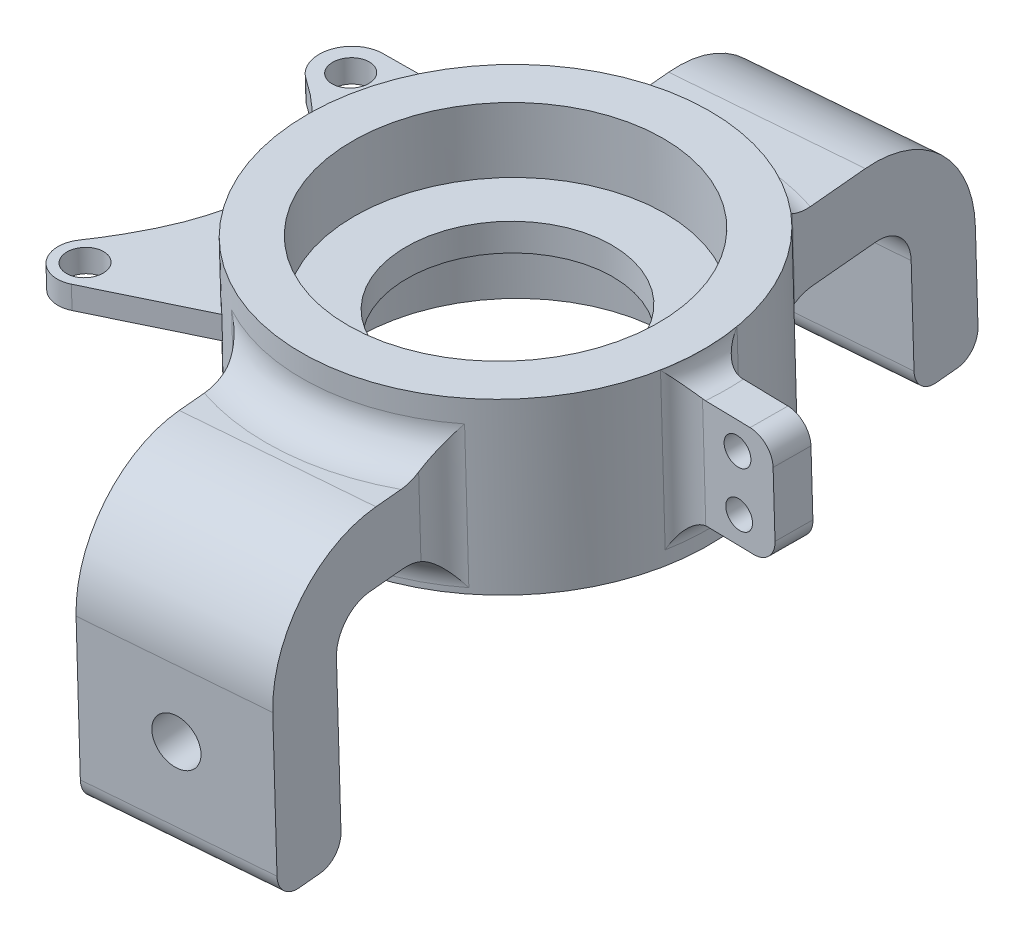
from build123d import *

# Parameters (mm, degrees)
BOSS_EXTRUDE1_DEPTH      = 20
BOSS_EXTRUDE1_DEPTH_BACK = 20
FILLET1_R                = 25
FILLET2_R                = 8
FILLET3_R                = 5
SKETCH2_R                = 5
CUT_EXTRUDE1_DEPTH       = 20
SKETCH5_R                = 5
CUT_EXTRUDE2_DEPTH       = 20
SKETCH6_R                = 44
CUT_EXTRUDE3_DEPTH       = 29.228201781
SKETCH7_R                = 44
SKETCH7_R_2              = 34
BOSS_EXTRUDE2_DEPTH      = 45.1
FILLET4_R                = 8
BOSS_EXTRUDE5_DEPTH      = 12
BOSS_EXTRUDE5_DEPTH_BACK = 12
FILLET9_R                = 5
SKETCH14_R               = 3
CUT_EXTRUDE6_DEPTH       = 8
FILLET10_R               = 5
SKETCH15_R               = 4
BOSS_EXTRUDE6_DEPTH      = 5
SKETCH17_R               = 34
SKETCH17_R_2             = 22.5
BOSS_EXTRUDE7_DEPTH      = 6
BOSS_EXTRUDE8_DEPTH      = 5
SKETCH7_3_R              = 44
SKETCH7_3_R_2            = 34
CUT_EXTRUDE7_DEPTH       = 5
SKETCH25_R               = 10.081703308
SKETCH25_R_2             = 0.081703308
SKETCH25_R_3             = 54
SKETCH25_R_4             = 44
SKETCH25_R_5             = 34
CUT_EXTRUDE_THIN1_DEPTH  = 3


with BuildPart() as part:
    # Sketch1 → Boss-Extrude1 (new, two sides: drawn at the far end of the back side and taken through both)
    with BuildSketch(Plane(origin=(4055.661832958, 41.633332154, -287.474453734), x_dir=(0.07069742445384515, 0.0007257432882496646, 0.9974975425895908), z_dir=(-0.9974449885157214, -0.010239255692916194, 0.07070114940881501)).offset(-BOSS_EXTRUDE1_DEPTH_BACK)):
        Polygon((678.273782418, 430.441094761), (679.200760243, 474.431329042), (679.558910767, 491.427555924), (600.714170206, 493.089000273), (514.836972154, 494.898635061), (513.806018968, 445.974193764), (528.802689745, 445.658178596), (529.517627764, 479.585949116), (600.398155038, 478.092329495), (664.246224821, 476.746900314), (663.27711164, 430.757109929), align=None)
    extrude(amount=BOSS_EXTRUDE1_DEPTH + BOSS_EXTRUDE1_DEPTH_BACK)

    # Fillet1
    fillet1_edges = [part.edges().sort_by_distance(p)[0] for p in [
        (4098.660421728, 533.528182084, 390.383889801),
        (4086.979374487, 536.879532503, 226.074160824),
    ]]
    fillet(fillet1_edges, radius=FILLET1_R)

    # Fillet2
    fillet2_edges = [part.edges().sort_by_distance(p)[0] for p in [
        (4097.728550367, 518.837186858, 375.1095232),
        (4088.17444288, 521.578307707, 240.718078718),
    ]]
    fillet(fillet2_edges, radius=FILLET2_R)

    # Fillet3
    fillet3_edges = [part.edges().sort_by_distance(p)[0] for p in [
        (4099.195589028, 472.544001376, 389.101977431),
        (4098.132119151, 472.849116161, 374.142835183),
        (4088.472165243, 487.651805842, 240.004929802),
        (4087.408695366, 487.956920627, 225.045787554),
    ]]
    fillet(fillet3_edges, radius=FILLET3_R)

    # Sketch2 → Cut-Extrude1 (cut)
    with BuildSketch(Plane(origin=(47.434645026, -13.609235045, 667.232441341), x_dir=(0.9974724331565, 0.006170459868801222, -0.07078608986135217), z_dir=(0.07089799180899715, -0.02034098567077171, 0.9972761498498763))):
        with Locations(Location((4064.120564402, 482.517070662, 0), (0, 0, 359.646383284))):
            Circle(SKETCH2_R)
    extrude(amount=-CUT_EXTRUDE1_DEPTH, mode=Mode.SUBTRACT)

    # Sketch5 → Cut-Extrude2 (cut)
    with BuildSketch(Plane(origin=(35.753597784, -10.257884626, 502.922712364), x_dir=(-0.9974724331564999, -0.006170459868801238, 0.07078608986135211), z_dir=(-0.07089799180899709, 0.02034098567076449, -0.9972761498498764))):
        with Locations(Location((-4065.090420908, 495.910145352, 0), (0, 0, 14.518396284))):
            Circle(SKETCH5_R)
    extrude(amount=-CUT_EXTRUDE2_DEPTH, mode=Mode.SUBTRACT)

    # Sketch6 → Cut-Extrude3 (cut)
    with BuildSketch(Plane(origin=(4093.325672873, 505.911695903, 311.122225444), x_dir=(-0.9999615144382686, -0.0087712968098642, -0.00018437623906450383), z_dir=(0.008773234427750432, -0.9997406673456855, -0.021014956885022845))):
        Circle(SKETCH6_R)
    extrude(amount=-CUT_EXTRUDE3_DEPTH, mode=Mode.SUBTRACT)


with BuildPart() as cut_extrude3_piece_1:
    # of the separate pieces the step leaves, piece 1, a body of its own (cut_extrude3_pieces)
    add(part.part.solids().sort_by_distance((4078.139353208, 477.643034383, 375.661932955))[0])



with BuildPart() as cut_extrude3_piece_2:
    # of the separate pieces the step leaves, piece 2, a body of its own (cut_extrude3_pieces)
    add(part.part.solids().sort_by_distance((4070.473323293, 520.728623305, 273.750170283))[0])


with BuildPart() as cut_extrude3_piece_1_1:
    add(cut_extrude3_piece_1.part)

    add(cut_extrude3_piece_2.part)  # Boss-Extrude2 merges Cut-Extrude3 piece 2
    # Sketch7 → Boss-Extrude2 (add)
    with BuildSketch(Plane(origin=(4093.325672873, 505.911695903, 311.122225444), x_dir=(-0.9999615144382686, -0.0087712968098642, -0.00018437623906450383), z_dir=(0.008773234427750432, -0.9997406673456855, -0.021014956885022845))):
        with Locations(Location((0, 0, 0), (0, 0, 90))):
            Circle(SKETCH7_R)
        with Locations(Location((0, 0, 0), (0, 0, 90))):
            Circle(SKETCH7_R_2, mode=Mode.SUBTRACT)
    extrude(amount=-BOSS_EXTRUDE2_DEPTH)

    # Fillet4
    fillet4_edges = [cut_extrude3_piece_1_1.edges().sort_by_distance(p)[0] for p in [
        (4075.964768954, 526.632277165, 352.077948853),
        (4115.862568495, 527.041847393, 349.249902876),
        (4096.188758646, 534.237314487, 355.616605438),
        (4096.320357163, 519.241204477, 355.301381085),
        (4081.273692716, 535.919695519, 269.354324938),
        (4110.305323576, 528.636248537, 271.079736483),
        (4070.407524035, 528.22667831, 273.90778246),
        (4081.405291233, 520.923585509, 269.039100585),
    ]]
    fillet(fillet4_edges, radius=FILLET4_R)

    # Sketch11 → Boss-Extrude5 (add, two sides: drawn at the far end of the back side and taken through both)
    with BuildSketch(Plane(origin=(4093.10590335, 530.95519962, 311.648650114), x_dir=(0.9999615144382689, 0.008771296809842058, 0.00018437623906403833), z_dir=(-0.008773234427728285, 0.9997406673456856, 0.021014956885022897)).offset(-BOSS_EXTRUDE5_DEPTH_BACK)):
        with BuildLine():
            Line((43.915086882, 2.732241594), (63.906736287, 2.154353999))
            Line((63.906736287, 2.154353999), (63.675581249, -5.842305763))
            Line((63.675581249, -5.842305763), (43.683931844, -5.264418168))
            ThreePointArc((43.683931844, -5.264418168), (43.981628691, -1.27135271), (43.915086882, 2.732241594))
        make_face()
    extrude(amount=BOSS_EXTRUDE5_DEPTH + BOSS_EXTRUDE5_DEPTH_BACK)

    # Fillet9
    fillet9_edges = [cut_extrude3_piece_1_1.edges().sort_by_distance(p)[0] for p in [
        (4136.788153994, 531.227728573, 316.919959885),
        (4137.191118196, 519.31736908, 312.675651724),
        (4137.019300136, 531.39781203, 308.92510885),
        (4136.98056057, 543.311145097, 313.180010689),
    ]]
    fillet(fillet9_edges, radius=FILLET9_R)

    # Sketch14 → Cut-Extrude6 (cut)
    with BuildSketch(Plane(origin=(-5.140011924, -3.782156998, 177.782026965), x_dir=(-0.9995821251662287, 0.0014831106206726194, -0.028868242604163267), z_dir=(0.0288932677515367, 0.021260432162118332, -0.9993563794277385))):
        with Locations(Location((-4155.362115115, 547.563566823, 0), (0, 0, 359.915004778))):
            Circle(SKETCH14_R)
        with Locations(Location((-4155.477862668, 535.564125065, 0), (0, 0, 179.915004778))):
            Circle(SKETCH14_R)
    extrude(amount=-CUT_EXTRUDE6_DEPTH, mode=Mode.SUBTRACT)

    # Fillet10
    fillet10_edges = [cut_extrude3_piece_1_1.edges().sort_by_distance(p)[0] for p in [
        (4156.999885893, 519.479090234, 313.251800835),
        (4156.789328267, 543.47286625, 313.756159801),
    ]]
    fillet(fillet10_edges, radius=FILLET10_R)

    # Sketch15 → Boss-Extrude6 (add)
    # profile 1 of 2: a face of its own
    with BuildSketch(Plane(origin=(4093.10590335, 530.95519962, 311.648650114), x_dir=(0.9999615144382689, 0.008771296809842058, 0.00018437623906403833), z_dir=(-0.008773234427728285, 0.9997406673456856, 0.021014956885022897))):
        with BuildLine():
            ThreePointArc((-30.33649782, 31.87), (-39.117469827, 20.145062779), (-43.562795192, 6.18731566))
            Line((-43.562795192, 6.18731566), (-62.766507398, 19.054741614))
            ThreePointArc((-62.766507398, 19.054741614), (-65.567268425, 26.906319142), (-58.87, 31.87))
            Line((-58.87, 31.87), (-30.33649782, 31.87))
        make_face()
        with Locations(Location((-58.87, 24.87, 0), (0, 0, 270))):
            Circle(SKETCH15_R, mode=Mode.SUBTRACT)
    # profile 2 of 2: a face of its own
    with BuildSketch(Plane(origin=(4093.10590335, 530.95519962, 311.648650114), x_dir=(0.9999615144382689, 0.008771296809842058, 0.00018437623906403833), z_dir=(-0.008773234427728285, 0.9997406673456856, 0.021014956885022897))):
        with BuildLine():
            ThreePointArc((-28.39352171, -33.612615562), (-36.765347144, -24.172489516), (-42.113841085, -12.744582734))
            Line((-42.113841085, -12.744582734), (-58.184093567, -34.863276925))
            ThreePointArc((-58.184093567, -34.863276925), (-57.975879829, -42.186814535), (-50.84045845, -43.849137557))
            Line((-50.84045845, -43.849137557), (-28.39352171, -33.612615562))
        make_face()
        with Locations(Location((-53.33, -38.39, 0), (0, 0, 270))):
            Circle(SKETCH15_R, mode=Mode.SUBTRACT)
    extrude(amount=BOSS_EXTRUDE6_DEPTH)

    # Sketch17 → Boss-Extrude7 (add)
    with BuildSketch(Plane(origin=(4093.080899632, 533.804460522, 311.708542742), x_dir=(-0.9999615144382686, -0.008771296809864201, -0.00018437623906450385), z_dir=(0.008773234427750434, -0.9997406673456855, -0.021014956885022848))):
        with Locations(Location((0, 0, 0), (0, 0, 90))):
            Circle(SKETCH17_R)
        with Locations(Location((0, 0, 0), (0, 0, 90))):
            Circle(SKETCH17_R_2, mode=Mode.SUBTRACT)
    extrude(amount=BOSS_EXTRUDE7_DEPTH)

    # Sketch23 → Boss-Extrude8 (add)
    with BuildSketch(Plane(origin=(-4.443266084, 506.325670075, 10.643172249), x_dir=(0.9999615144382689, 0.00877129680984245, 0.00018437623906404876), z_dir=(-0.008773234427728678, 0.9997406673456856, 0.02101495688502314))):
        with BuildLine():
            Line((4054.100208933, -294.23407504), (4034.896496727, -281.366649087))
            add(Edge.make_bspline(
                [(4034.896496727, -281.366649087), (4053.94624457, -294.263865002), (4056.774629376, -311.163381607), (4039.478910558, -335.284667626)],
                knots=[0, 0, 0, 0, 1, 1, 1, 1], degree=3))
            Line((4039.478910558, -335.284667626), (4055.54916304, -313.165973435))
            ThreePointArc((4055.54916304, -313.165973435), (4053.791308293, -303.779113868), (4054.100208933, -294.23407504))
        make_face()
    extrude(amount=-BOSS_EXTRUDE8_DEPTH)

    # Sketch7<3> → Cut-Extrude7 (cut, symmetric)
    with BuildSketch(Plane(origin=(4093.325672873, 505.911695903, 311.122225444), x_dir=(-0.9999615144382686, -0.0087712968098642, -0.00018437623906450383), z_dir=(0.008773234427750432, -0.9997406673456855, -0.021014956885022845))):
        with Locations(Location((0, 0, 0), (0, 0, 90))):
            Circle(SKETCH7_3_R)
        with Locations(Location((0, 0, 0), (0, 0, 90))):
            Circle(SKETCH7_3_R_2, mode=Mode.SUBTRACT)
    extrude(amount=CUT_EXTRUDE7_DEPTH, both=True, mode=Mode.SUBTRACT)

    # Sketch25 → Cut-Extrude-Thin1 (cut)
    # profile 1 of 3: a face of its own
    with BuildSketch(Plane(origin=(-4.575303262, 521.371767119, 10.95944735), x_dir=(0.9999615144382686, 0.0087712968098642, 0.00018437623906450372), z_dir=(-0.008773234427750432, 0.9997406673456855, 0.02101495688502285))):
        with Locations((4071.569795904, -335.747885985)):
            Circle(SKETCH25_R)
        with Locations((4071.569795904, -335.747885985)):
            Circle(SKETCH25_R_2, mode=Mode.SUBTRACT)
    # profile 2 of 3: a face of its own
    with BuildSketch(Plane(origin=(-4.575303262, 521.371767119, 10.95944735), x_dir=(0.9999615144382686, 0.0087712968098642, 0.00018437623906450372), z_dir=(-0.008773234427750432, 0.9997406673456855, 0.02101495688502285))):
        with Locations((4097.663004125, -300.421390701)):
            Circle(SKETCH25_R_3)
        with Locations((4097.663004125, -300.421390701)):
            Circle(SKETCH25_R_4, mode=Mode.SUBTRACT)
    # profile 3 of 3: a face of its own
    with BuildSketch(Plane(origin=(-4.575303262, 521.371767119, 10.95944735), x_dir=(0.9999615144382686, 0.0087712968098642, 0.00018437623906450372), z_dir=(-0.008773234427750432, 0.9997406673456855, 0.02101495688502285))):
        with Locations((4097.663004125, -300.421390701)):
            Circle(SKETCH25_R_4)
        with Locations((4097.663004125, -300.421390701)):
            Circle(SKETCH25_R_5, mode=Mode.SUBTRACT)
    extrude(amount=-CUT_EXTRUDE_THIN1_DEPTH, mode=Mode.SUBTRACT)


solid = cut_extrude3_piece_1_1.part
